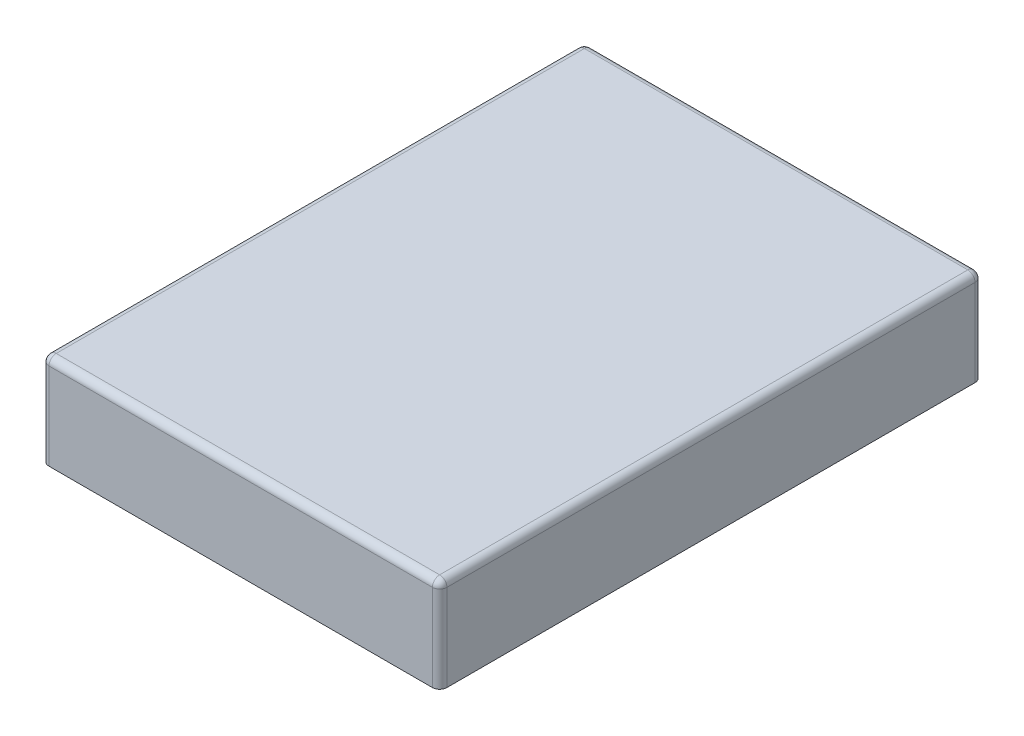
from build123d import *

# Parameters (mm, degrees)
SKETCH1_W           = 55
SKETCH1_H           = 75
BOSS_EXTRUDE1_DEPTH = 13
FILLET1_R           = 1


with BuildPart() as part:
    # Sketch1 → Boss-Extrude1 (new body)
    with BuildSketch(Plane(origin=(0, 0, 0), x_dir=(1, 0, 0), z_dir=(0, 1, 0))):
        Rectangle(SKETCH1_W, SKETCH1_H)
    extrude(amount=BOSS_EXTRUDE1_DEPTH)

    # Fillet1
    fillet1_edges = [part.edges().sort_by_distance(p)[0] for p in [
        (-27.5, 13, 0),
        (0, 13, 37.5),
        (27.5, 13, 0),
        (27.5, 6.5, 37.5),
        (-27.5, 6.5, 37.5),
        (-27.5, 6.5, -37.5),
        (27.5, 6.5, -37.5),
        (0, 13, -37.5),
    ]]
    fillet(fillet1_edges, radius=FILLET1_R)


solid = part.part
